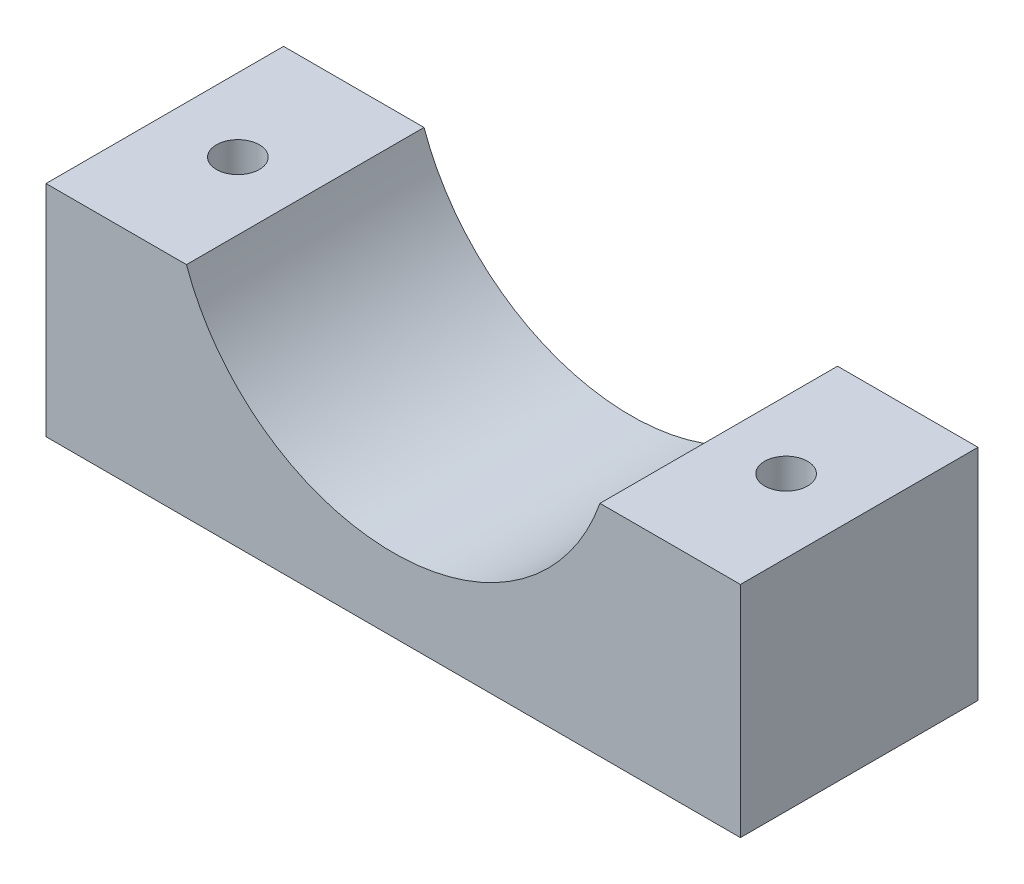
from build123d import *

# Parameters (mm, degrees)
SKETCH1_W           = 38
SKETCH1_H           = 13
BOSS_EXTRUDE1_DEPTH = 12
SKETCH2_R           = 12
CUT_EXTRUDE1_DEPTH  = 13
HOLE1_D             = 2.35


with BuildPart() as part:
    # Sketch1 → Boss-Extrude1 (new body)
    with BuildSketch(Plane(origin=(0, 0, 0), x_dir=(1, 0, 0), z_dir=(0, 1, 0))):
        with Locations((19, 6.5)):
            Rectangle(SKETCH1_W, SKETCH1_H)
    extrude(amount=BOSS_EXTRUDE1_DEPTH)

    # Sketch2 → Cut-Extrude1 (cut)
    with BuildSketch(Plane.XY):
        with Locations((19, 16)):
            Circle(SKETCH2_R)
    extrude(amount=-CUT_EXTRUDE1_DEPTH, mode=Mode.SUBTRACT)

    # Hole1 (through all)
    with Locations(Plane(origin=(0, 0, 0), x_dir=(-1, 0, 0), z_dir=(0, -1, 0))):
        with Locations((-34, 6.5), (-4, 6.5)):
            Hole(HOLE1_D / 2)


solid = part.part
